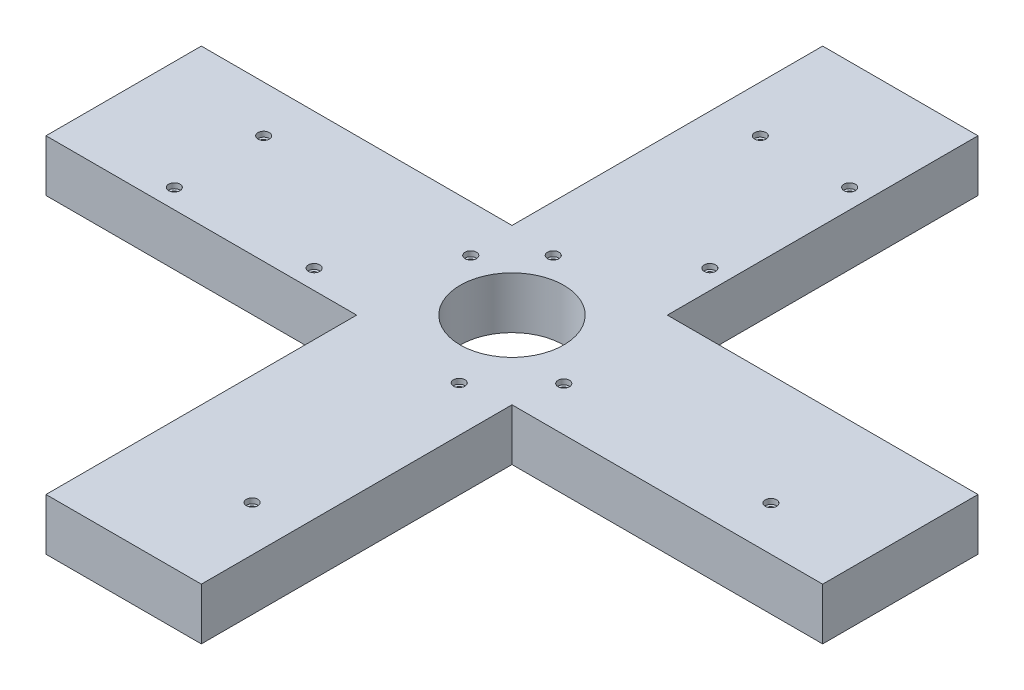
from build123d import *

# Parameters (mm, degrees)
SKETCH1_W                      = 300
SKETCH1_H                      = 300
BOSS_EXTRUDE1_DEPTH            = 20
SKETCH2_W                      = 120
SKETCH2_H                      = 120
CUT_EXTRUDE1_DEPTH             = 214.072757527
CBORE_FOR_M2_SHCS1_D           = 2.4
CBORE_FOR_M2_SHCS1_CBORE_D     = 4.4
CBORE_FOR_M2_SHCS1_CBORE_DEPTH = 2
CBORE_FOR_M2_SHCS2_D           = 2.4
CBORE_FOR_M2_SHCS2_CBORE_D     = 4.4
CBORE_FOR_M2_SHCS2_CBORE_DEPTH = 2
CBORE_FOR_M2_SHCS3_D           = 2.4
CBORE_FOR_M2_SHCS3_CBORE_D     = 4.4
CBORE_FOR_M2_SHCS3_CBORE_DEPTH = 2
SKETCH12_R                     = 20
CUT_EXTRUDE2_DEPTH             = 214.072757527


with BuildPart() as part:
    # Sketch1 → Boss-Extrude1 (new body)
    with BuildSketch(Plane(origin=(0, 0, 0), x_dir=(1, 0, 0), z_dir=(0, 1, 0))):
        Rectangle(SKETCH1_W, SKETCH1_H)
    extrude(amount=BOSS_EXTRUDE1_DEPTH)

    # Sketch2 → Cut-Extrude1 (cut, through all)
    with BuildSketch(Plane(origin=(0, 20, 0), x_dir=(1, 0, 0), z_dir=(0, 1, 0))):
        with Locations((-90, 90)):
            Rectangle(SKETCH2_W, SKETCH2_H)
        with Locations((90, 90)):
            Rectangle(SKETCH2_W, SKETCH2_H)
        with Locations((-90, -90)):
            Rectangle(SKETCH2_W, SKETCH2_H)
        with Locations((90, -90)):
            Rectangle(SKETCH2_W, SKETCH2_H)
    extrude(amount=-CUT_EXTRUDE1_DEPTH, mode=Mode.SUBTRACT)

    # CBORE for M2 SHCS1 (through all)
    with Locations(Plane(origin=(0, 20, 0), x_dir=(1, 0, 0), z_dir=(0, 1, 0))):
        with Locations((-53.93, -22.5), (-107.93, -22.5), (32.88, -12.88), (112.88, -12.88)):
            CounterBoreHole(CBORE_FOR_M2_SHCS1_D / 2, CBORE_FOR_M2_SHCS1_CBORE_D / 2, CBORE_FOR_M2_SHCS1_CBORE_DEPTH)

    # CBORE for M2 SHCS2 (through all)
    with Locations(Plane(origin=(0, 20, 0), x_dir=(1, 0, 0), z_dir=(0, 1, 0))):
        with Locations((22.5, 53.93), (22.5, 107.93), (12.5, -32.88), (12.5, -112.88)):
            CounterBoreHole(CBORE_FOR_M2_SHCS2_D / 2, CBORE_FOR_M2_SHCS2_CBORE_D / 2, CBORE_FOR_M2_SHCS2_CBORE_DEPTH)

    # CBORE for M2 SHCS3 (through all)
    with Locations(Plane(origin=(0, 20, 0), x_dir=(1, 0, 0), z_dir=(0, 1, 0))):
        with Locations((-27.93, 12), (-107.93, 12), (-12, 27.93), (-12, 107.93)):
            CounterBoreHole(CBORE_FOR_M2_SHCS3_D / 2, CBORE_FOR_M2_SHCS3_CBORE_D / 2, CBORE_FOR_M2_SHCS3_CBORE_DEPTH)

    # Sketch12 → Cut-Extrude2 (cut, through all)
    with BuildSketch(Plane(origin=(0, 20, 0), x_dir=(1, 0, 0), z_dir=(0, 1, 0))):
        with Locations(Location((0, 0, 0), (0, 0, 270))):
            Circle(SKETCH12_R)
    extrude(amount=-CUT_EXTRUDE2_DEPTH, mode=Mode.SUBTRACT)


solid = part.part
